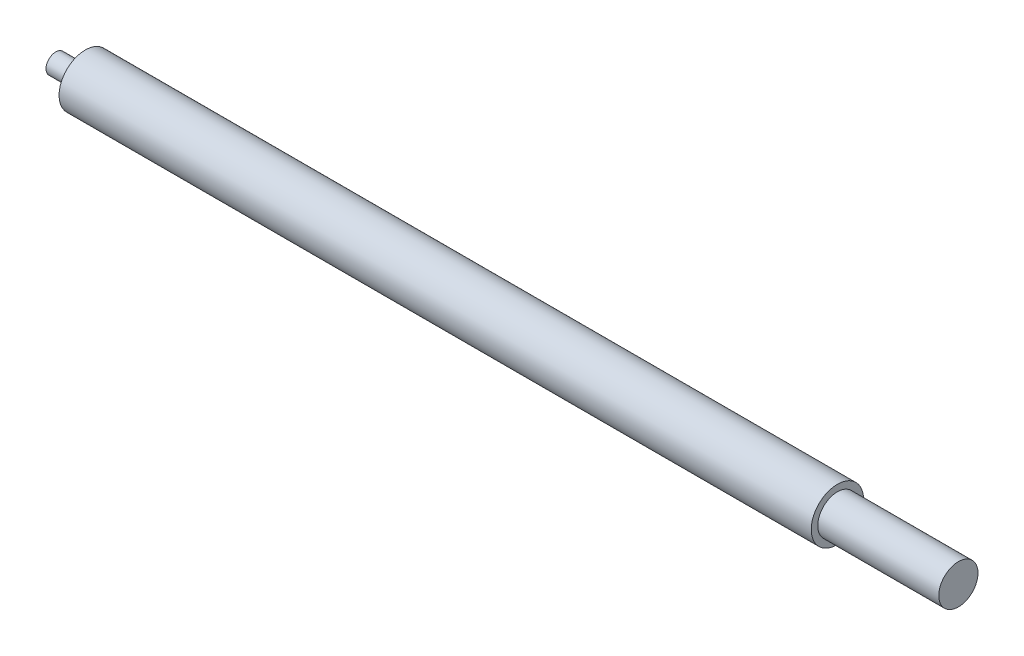
from build123d import *

# Parameters (mm, degrees)
SKETCH_1_R      = 8
EXTRUDE_1_DEPTH = 115
SKETCH_2_R      = 6
EXTRUDE_2_DEPTH = 37
SKETCH_5_R      = 3
EXTRUDE_4_DEPTH = 9


with BuildPart() as part:
    # 草图1 → 凸台-拉伸1 (new, symmetric)
    with BuildSketch(Plane(origin=(0, 0, 0), x_dir=(0, 0, -1), z_dir=(1, 0, 0))):
        Circle(SKETCH_1_R)
    extrude(amount=EXTRUDE_1_DEPTH, both=True)

    # 草图2 → 凸台-拉伸2 (add)
    with BuildSketch(Plane(origin=(115, 0, 0), x_dir=(0, 0, -1), z_dir=(1, 0, 0))):
        Circle(SKETCH_2_R)
    extrude(amount=EXTRUDE_2_DEPTH)

    # 草图5 → 凸台-拉伸4 (add, symmetric)
    with BuildSketch(Plane.ZY.offset(115)):
        with Locations(Location((0, 0, 0), (0, 0, 180))):
            Circle(SKETCH_5_R)
    extrude(amount=EXTRUDE_4_DEPTH, both=True)


solid = part.part
